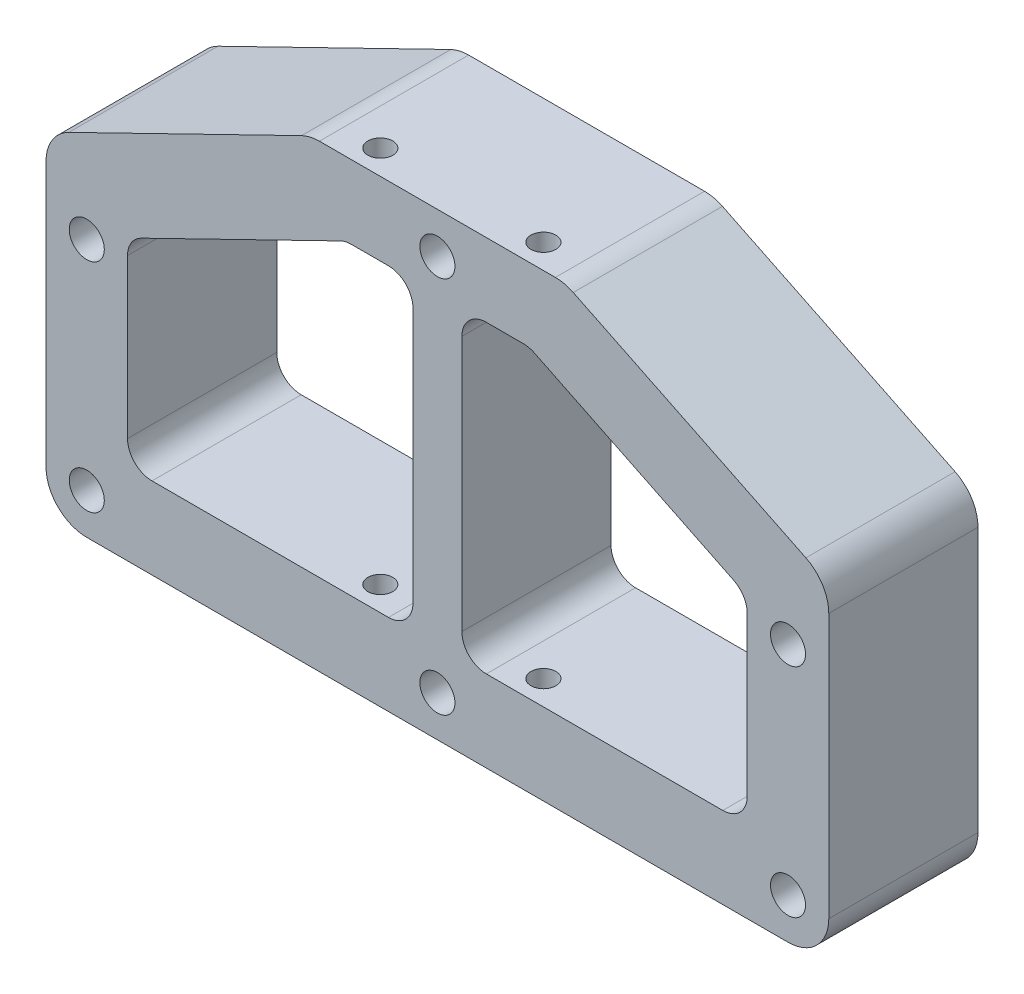
from build123d import *

# Parameters (mm, degrees)
SKETCH_1_R               = 6
EXTRUDE_1_DEPTH          = 18.3
CUT_EXTRUDE_1_DEPTH      = 38
SKETCH_3_R               = 2.15
CUT_EXTRUDE_2_DEPTH      = 74
CUT_EXTRUDE_START        = -74
SKETCH_5_W               = 10
SKETCH_5_H               = 40.552439024
CUT_EXTRUDE_3_DEPTH      = 156.521752466
CUT_EXTRUDE_4_DEPTH      = 40
SKETCH_8_W               = 6
SKETCH_8_H               = 37.346305337
EXTRUDE_2_DEPTH          = 18.3
FILLET_2_R               = 3
FILLET_3_R               = 5
CUT_EXTRUDE_7_DEPTH      = 80
CUT_EXTRUDE_7_DEPTH_BACK = 40
SKETCH_12_R              = 1.525


with BuildPart() as part:
    # 草图1 → 凸台-拉伸1 (new body)
    with BuildSketch(Plane.XY):
        with BuildLine():
            Line((-8.281928864, 111.239451243), (-56, 56.65))
            Line((-56, 56.65), (-56, 0))
            Line((-56, 0), (56, 0))
            Line((56, 0), (56, 56.65))
            Line((56, 56.65), (8.281928864, 111.239451243))
            ThreePointArc((8.281928864, 111.239451243), (0, 115), (-8.281928864, 111.239451243))
        make_face()
        with Locations((0, 104)):
            Circle(SKETCH_1_R, mode=Mode.SUBTRACT)
    extrude(amount=EXTRUDE_1_DEPTH)

    # 草图2 → Cut-Extrude 1 (cut)
    with BuildSketch(Plane.XY.offset(18.3)):
        Polygon((15.622574059, 56.346305337), (56, 36.65), (56, 56.65), (30, 116.346305337), (-30, 116.346305337), (-56, 56.65), (-56, 36.65), (-15.622574059, 56.346305337), align=None)
    extrude(amount=-CUT_EXTRUDE_1_DEPTH, mode=Mode.SUBTRACT)

    # 草图3 → 切除-拉伸2 (cut)
    with BuildSketch(Plane.XY.offset(18.3)):
        with Locations((0, 51.346305337)):
            Circle(SKETCH_3_R)
        with Locations((43, 31.65)):
            Circle(SKETCH_3_R)
        with Locations((43, 5)):
            Circle(SKETCH_3_R)
        with Locations((-43, 5)):
            Circle(SKETCH_3_R)
        with Locations((-43, 31.65)):
            Circle(SKETCH_3_R)
        with Locations((0, 5)):
            Circle(SKETCH_3_R)
    extrude(amount=-CUT_EXTRUDE_2_DEPTH, mode=Mode.SUBTRACT)

    # 草图5 → Cut-Extrude 3 (cut)
    with BuildSketch(Plane.XY.offset(18.3).offset(CUT_EXTRUDE_START)):
        with Locations((53, 20.276219512)):
            Rectangle(SKETCH_5_W, SKETCH_5_H)
    cut_extrude_3 = extrude(amount=CUT_EXTRUDE_3_DEPTH, mode=Mode.SUBTRACT)

    # 镜向2: Cut-Extrude 3 across plane
    add(cut_extrude_3.mirror(Plane(origin=(0, 0, 0), x_dir=(0, 0, 1), z_dir=(1, 0, 0))), mode=Mode.SUBTRACT)

    # 草图7 → 切除-拉伸4 (cut)
    with BuildSketch(Plane(origin=(0, 0, 0), x_dir=(-1, 0, 0), z_dir=(0, 0, -1))):
        Polygon((-38, 34.304151485), (-38, 10), (38, 10), (38, 34.304151485), (11.263584603, 47.346305337), (-11.263584603, 47.346305337), align=None)
    extrude(amount=-CUT_EXTRUDE_4_DEPTH, mode=Mode.SUBTRACT)

    # 草图8 → 凸台-拉伸2 (add)
    with BuildSketch(Plane(origin=(0, 0, 0), x_dir=(-1, 0, 0), z_dir=(0, 0, -1))):
        with Locations((0, 28.673152669)):
            Rectangle(SKETCH_8_W, SKETCH_8_H)
    extrude(amount=-EXTRUDE_2_DEPTH)

    # 圆角2
    fillet_2_edges = [part.edges().sort_by_distance(p)[0] for p in [
        (38, 34.304151485, 9.15),
        (11.263584603, 47.346305337, 9.15),
        (-11.263584603, 47.346305337, 9.15),
        (-38, 34.304151485, 9.15),
        (-38, 10, 9.15),
        (38, 10, 9.15),
        (3, 10, 9.15),
        (-3, 10, 9.15),
        (-3, 47.346305337, 9.15),
        (3, 47.346305337, 9.15),
    ]]
    fillet(fillet_2_edges, radius=FILLET_2_R)

    # 圆角3
    fillet_3_edges = [part.edges().sort_by_distance(p)[0] for p in [
        (-48, 40.552439024, 9.15),
        (-48, 0, 9.15),
        (15.622574059, 56.346305337, 9.15),
        (-15.622574059, 56.346305337, 9.15),
        (48, 40.552439024, 9.15),
        (48, 0, 9.15),
    ]]
    fillet(fillet_3_edges, radius=FILLET_3_R)

    # 草图12 → 切除-拉伸7 (cut, two sides: drawn at the far end of the back side and taken through both)
    with BuildSketch(Plane(origin=(0, 10, 0), x_dir=(1, 0, 0), z_dir=(0, 1, 0)).offset(-CUT_EXTRUDE_7_DEPTH_BACK)):
        with Locations(Location((-10, -15.3, 0), (0, 0, 90))):
            Circle(SKETCH_12_R)
        with Locations(Location((10, -15.3, 0), (0, 0, 90))):
            Circle(SKETCH_12_R)
    extrude(amount=CUT_EXTRUDE_7_DEPTH + CUT_EXTRUDE_7_DEPTH_BACK, mode=Mode.SUBTRACT)


solid = part.part
